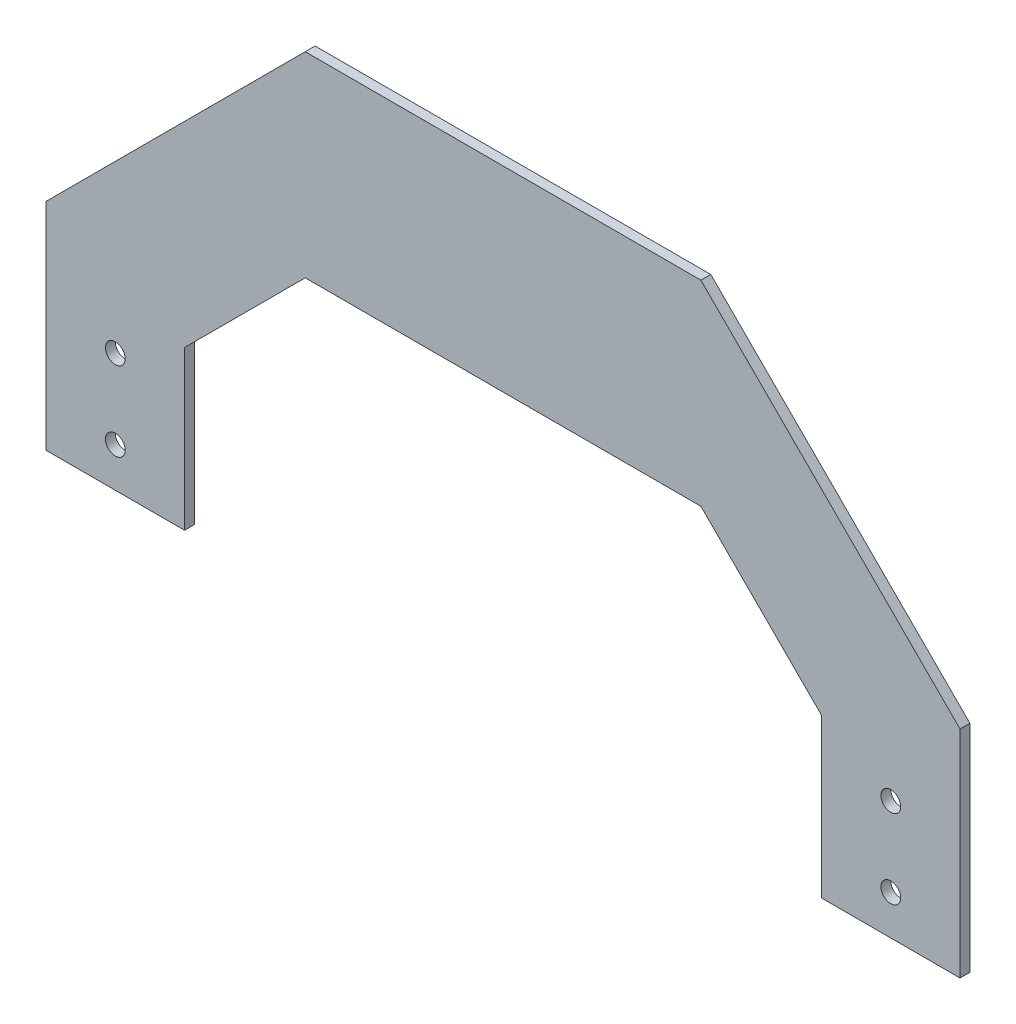
from build123d import *

# Parameters (mm, degrees)
BOSS_EXTRUDE1_DEPTH = 3.175
SKETCH4_R           = 3.175
CUT_EXTRUDE2_DEPTH  = 3.175


with BuildPart() as part:
    # Sketch1 → Boss-Extrude1 (new body)
    with BuildSketch(Plane.XY):
        Polygon((-63.5, 31.430896424), (-146.688207153, -51.757310729), (-146.688207153, -120.969103576), (-102.238207153, -120.969103576), (-102.238207153, -70.169103576), (-63.5, -31.430896424), (0, -31.430896424), (0, 31.430896424), align=None)
    boss_extrude1 = extrude(amount=BOSS_EXTRUDE1_DEPTH)

    # Sketch4 → Cut-Extrude2 (cut)
    with BuildSketch(Plane.XY.offset(3.175)):
        with Locations((-124.463207153, -108.269103576)):
            Circle(SKETCH4_R)
        with Locations((-124.463207153, -82.869103576)):
            Circle(SKETCH4_R)
    cut_extrude2 = extrude(amount=-CUT_EXTRUDE2_DEPTH, mode=Mode.SUBTRACT)

    # Mirror4: Boss-Extrude1, Cut-Extrude2 across plane
    add(boss_extrude1.mirror(Plane(origin=(0, 31.430896424, 3.175), x_dir=(0, 0, 1), z_dir=(-1, 0, 0))))
    add(cut_extrude2.mirror(Plane(origin=(0, 31.430896424, 3.175), x_dir=(0, 0, 1), z_dir=(-1, 0, 0))), mode=Mode.SUBTRACT)


solid = part.part
